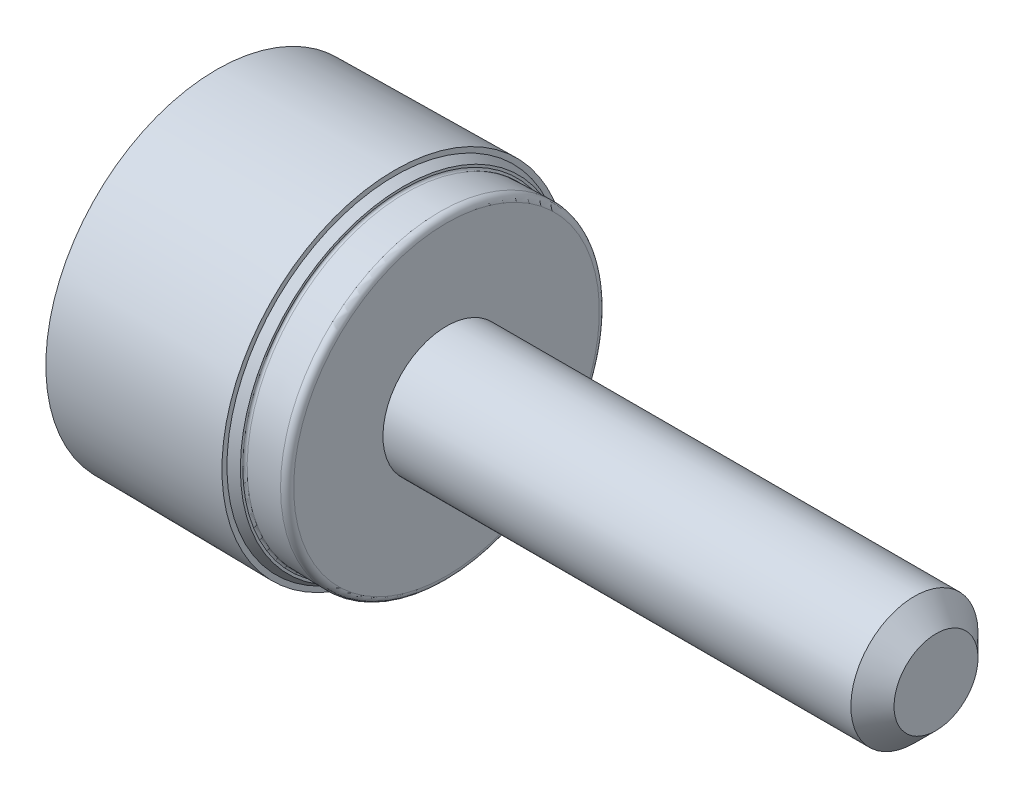
from build123d import *

# Parameters (mm, degrees)
CHAMFER2_SIZE = 0.5953125


with BuildPart() as part:
    # Sketch3 → Revolve1 (revolve)
    with BuildSketch(Plane.XY):
        with BuildLine():
            Line((-10.702925, 2.8702), (-10.702925, 4.708465665))
            Line((-10.702925, 4.708465665), (-5.794375, 4.7625))
            Line((-5.794375, 4.7625), (-5.794375, 4.625018467))
            Line((-5.794375, 4.625018467), (-5.55625, 4.493023624))
            Line((-5.55625, 4.493023624), (-5.55625, 4.42689468))
            ThreePointArc((-5.55625, 4.42689468), (-5.538212237, 4.384141282), (-5.495001316, 4.367228853))
            Line((-5.495001316, 4.367228853), (-4.549371052, 4.391991053))
            ThreePointArc((-4.549371052, 4.391991053), (-4.419738289, 4.341253768), (-4.365625, 4.212993574))
            Line((-4.365625, 4.212993574), (-4.365625, 1.575604266))
            Line((-4.365625, 1.575604266), (-5.622925, 1.575604266))
            Line((-5.622925, 1.575604266), (-5.622925, 2.8702))
            Line((-5.622925, 2.8702), (-10.702925, 2.8702))
        make_face()
    revolve(axis=Axis((-9.128125, 0, 0), (1, 0, 0)))

    # Sketch4 → Revolve2 (revolve)
    with BuildSketch(Plane.XY):
        Polygon((-10.702925, 2.8702), (-5.622925, 2.8702), (-5.622925, 1.7526), (9.128125, 1.7526), (9.128125, 0), (-10.702925, 0), align=None)
    revolve(axis=Axis((-10.702925, 0, 0), (1, 0, 0)))

    # Chamfer2
    chamfer2_edges = [part.edges().sort_by_distance(p)[0] for p in [
        (9.128125, -1.7526, 0),
    ]]
    chamfer(chamfer2_edges, length=CHAMFER2_SIZE)


solid = part.part
